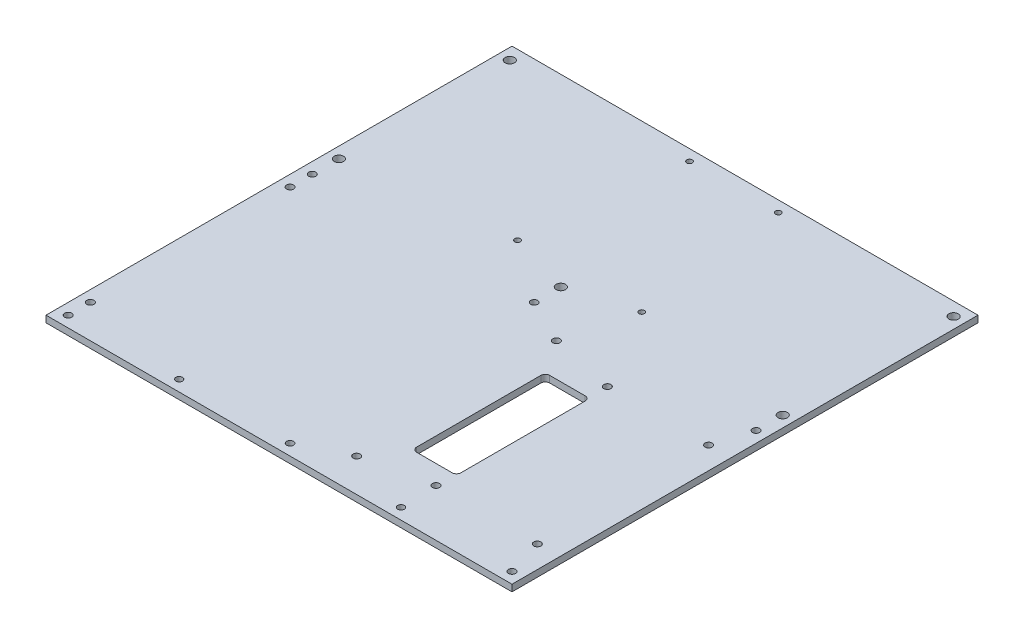
from build123d import *

# Parameters (mm, degrees)
SKETCH_1_W               = 210
SKETCH_1_H               = 250
EXTRUDE_1_DEPTH          = 3
SKETCH_2_W               = 210
SKETCH_2_H               = 130
CUT_EXTRUDE_1_DEPTH      = 164.275840221
CUT_EXTRUDE_2_DEPTH      = 164.275840221
CUT_EXTRUDE_2_DEPTH_BACK = 164.275840221
SKETCH_4_W               = 20
SKETCH_4_H               = 60
FILLET_2_R               = 2
CUT_EXTRUDE_3_DEPTH      = 164.275840221
CUT_EXTRUDE_3_DEPTH_BACK = 164.275840221
SKETCH_7_R               = 1.6
SKETCH_7_R_2             = 1.55
SKETCH_8_R               = 1.6
SKETCH_8_R_2             = 1.5
CUT_EXTRUDE_4_DEPTH      = 164.275840221
SKETCH_9_W               = 210
SKETCH_9_H               = 90
EXTRUDE_2_DEPTH          = 3
SKETCH_10_R              = 2.1
CUT_EXTRUDE_5_DEPTH      = 10
SKETCH_11_R              = 1.25
CUT_EXTRUDE_6_DEPTH      = 240.288528768
SKETCH_12_R              = 2.1
CUT_EXTRUDE_7_DEPTH      = 10


with BuildPart() as part:
    # 草图1 → 凸台-拉伸1 (new body)
    with BuildSketch(Plane(origin=(0, 0, 0), x_dir=(1, 0, 0), z_dir=(0, 1, 0))):
        Rectangle(SKETCH_1_W, SKETCH_1_H)
    extrude(amount=EXTRUDE_1_DEPTH)

    # 草图2 → 切除-拉伸1 (cut, through all)
    with BuildSketch(Plane(origin=(0, 0, 0), x_dir=(1, 0, 0), z_dir=(0, 1, 0))):
        with Locations((0, -60)):
            Rectangle(SKETCH_2_W, SKETCH_2_H)
    extrude(amount=CUT_EXTRUDE_1_DEPTH, mode=Mode.SUBTRACT)

    # 草图4 → 切除-拉伸2 (cut, two sides: drawn at the far end of the back side and taken through both)
    with BuildSketch(Plane(origin=(0, 3, 0), x_dir=(1, 0, 0), z_dir=(0, 1, 0)).offset(-CUT_EXTRUDE_2_DEPTH_BACK)):
        with Locations((40, 65)):
            Rectangle(SKETCH_4_W, SKETCH_4_H)
    extrude(amount=CUT_EXTRUDE_2_DEPTH + CUT_EXTRUDE_2_DEPTH_BACK, mode=Mode.SUBTRACT)

    # 圆角2
    fillet_2_edges = [part.edges().sort_by_distance(p)[0] for p in [
        (50, 1.5, -95),
        (50, 1.5, -35),
        (30, 1.5, -35),
        (30, 1.5, -95),
    ]]
    fillet(fillet_2_edges, radius=FILLET_2_R)

    # 草图7 → 切除-拉伸3 (cut, two sides: drawn at the far end of the back side and taken through both)
    with BuildSketch(Plane(origin=(0, 3, 0), x_dir=(1, 0, 0), z_dir=(0, 1, 0)).offset(-CUT_EXTRUDE_3_DEPTH_BACK)):
        with Locations(Location((100, 120, 0), (0, 0, 270))):
            Circle(SKETCH_7_R)
        with Locations(Location((0, 120, 0), (0, 0, 270))):
            Circle(SKETCH_7_R_2)
        with Locations(Location((-100, 120, 0), (0, 0, 270))):
            Circle(SKETCH_7_R)
        with Locations(Location((-100, 10, 0), (0, 0, 270))):
            Circle(SKETCH_7_R)
        with Locations(Location((0, 10, 0), (0, 0, 270))):
            Circle(SKETCH_7_R_2)
        with Locations(Location((100, 10, 0), (0, 0, 270))):
            Circle(SKETCH_7_R)
    extrude(amount=CUT_EXTRUDE_3_DEPTH + CUT_EXTRUDE_3_DEPTH_BACK, mode=Mode.SUBTRACT)

    # 草图8 → 切除-拉伸4 (cut, through all)
    with BuildSketch(Plane(origin=(0, 3, 0), x_dir=(1, 0, 0), z_dir=(0, 1, 0))):
        with Locations(Location((20, 20, 0), (0, 0, 270))):
            Circle(SKETCH_8_R)
        with Locations(Location((-100, 20, 0), (0, 0, 270))):
            Circle(SKETCH_8_R)
        with Locations(Location((-100, 110, 0), (0, 0, 270))):
            Circle(SKETCH_8_R)
        with Locations(Location((20, 110, 0), (0, 0, 270))):
            Circle(SKETCH_8_R)
        with Locations(Location((-50, 10, 0), (0, 0, 270))):
            Circle(SKETCH_8_R_2)
        with Locations(Location((50, 10, 0), (0, 0, 90))):
            Circle(SKETCH_8_R_2)
        with Locations(Location((95, 26.4, 0), (0, 0, 270))):
            Circle(SKETCH_8_R)
        with Locations(Location((49.36, 26.4, 0), (0, 0, 270))):
            Circle(SKETCH_8_R)
        with Locations(Location((49.36, 103.6, 0), (0, 0, 270))):
            Circle(SKETCH_8_R)
        with Locations(Location((95, 103.6, 0), (0, 0, 270))):
            Circle(SKETCH_8_R)
    extrude(amount=-CUT_EXTRUDE_4_DEPTH, mode=Mode.SUBTRACT)

    # 草图9 → 凸台-拉伸2 (add)
    with BuildSketch(Plane(origin=(0, 3, 0), x_dir=(1, 0, 0), z_dir=(0, 1, 0))):
        with Locations((0, 170)):
            Rectangle(SKETCH_9_W, SKETCH_9_H)
    extrude(amount=-EXTRUDE_2_DEPTH)

    # 草图10 → 切除-拉伸5 (cut)
    with BuildSketch(Plane(origin=(0, 3, 0), x_dir=(1, 0, 0), z_dir=(0, 1, 0))):
        with Locations(Location((100, 132, 0), (0, 0, 270))):
            Circle(SKETCH_10_R)
        with Locations(Location((-100, 132, 0), (0, 0, 270))):
            Circle(SKETCH_10_R)
        with Locations(Location((0, 132, 0), (0, 0, 270))):
            Circle(SKETCH_10_R)
    extrude(amount=-CUT_EXTRUDE_5_DEPTH, mode=Mode.SUBTRACT)

    # 草图11 → 切除-拉伸6 (cut, through all)
    with BuildSketch(Plane(origin=(0, 0, 0), x_dir=(-1, 0, 0), z_dir=(0, -1, 0))):
        with Locations(Location((20, 210, 0), (0, 0, 90))):
            Circle(SKETCH_11_R)
        with Locations(Location((-20, 210, 0), (0, 0, 90))):
            Circle(SKETCH_11_R)
        with Locations(Location((28, 140.458645397, 0), (0, 0, 270))):
            Circle(SKETCH_11_R)
        with Locations(Location((-28, 140.458645397, 0), (0, 0, 90))):
            Circle(SKETCH_11_R)
    extrude(amount=-CUT_EXTRUDE_6_DEPTH, mode=Mode.SUBTRACT)

    # 草图12 → 切除-拉伸7 (cut)
    with BuildSketch(Plane(origin=(0, 3, 0), x_dir=(1, 0, 0), z_dir=(0, 1, 0))):
        with Locations(Location((100, 209, 0), (0, 0, 270))):
            Circle(SKETCH_12_R)
        with Locations(Location((-100, 209, 0), (0, 0, 270))):
            Circle(SKETCH_12_R)
    extrude(amount=-CUT_EXTRUDE_7_DEPTH, mode=Mode.SUBTRACT)


solid = part.part
